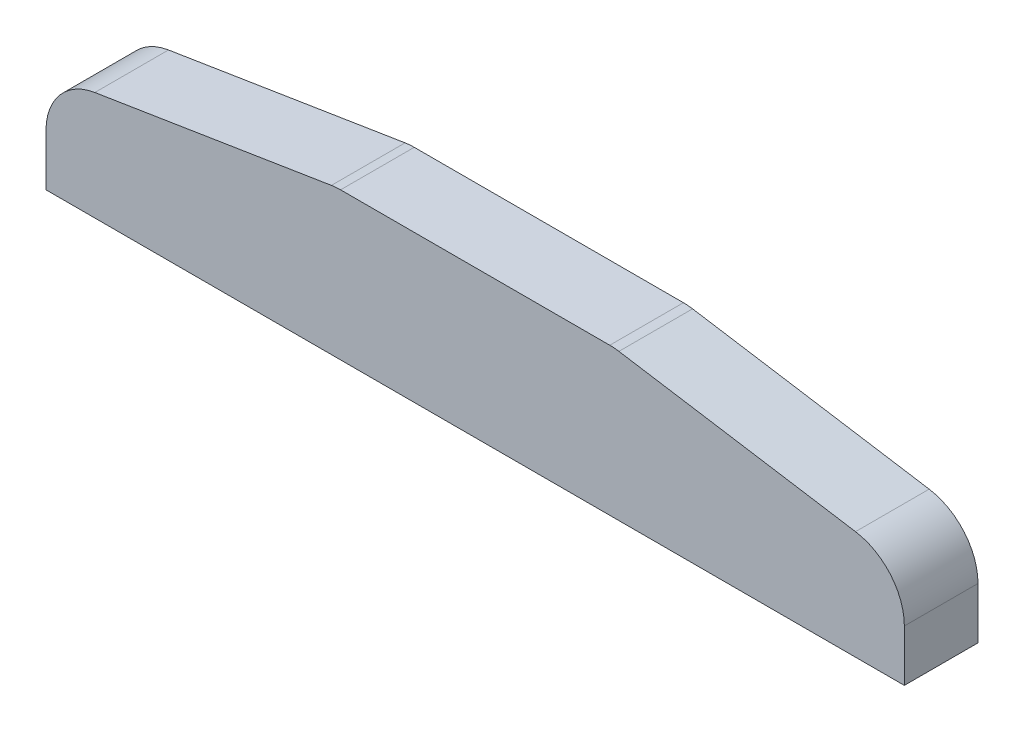
from build123d import *
from OCP.BRepFilletAPI import BRepFilletAPI_MakeChamfer

# Parameters (mm, degrees)
SKETCH1_W                 = 148
SKETCH1_H                 = 12.7
BOSS_EXTRUDE1_DEPTH       = 25.4
CHAMFER1_SIZE             = 8
CHAMFER1_SIZE2            = 50
M5X0_8_TAPPED_HOLE1_D     = 4.2
M5X0_8_TAPPED_HOLE1_DEPTH = 12
M5X0_8_TAPPED_HOLE1_TIP   = 1.2618073
FILLET1_R                 = 10


with BuildPart() as part:
    # Sketch1 → Boss-Extrude1 (new body)
    with BuildSketch(Plane(origin=(0, 0, 0), x_dir=(1, 0, 0), z_dir=(0, 1, 0))):
        Rectangle(SKETCH1_W, SKETCH1_H)
    extrude(amount=BOSS_EXTRUDE1_DEPTH)

    # Chamfer1: one chamfer whose edges measure the first distance from different faces: ONE call of the kernel's chamfer builder (chamfer() names one face for all edges)
    chamfer1_edges_1 = [part.edges().sort_by_distance(p)[0] for p in [
        (-74, 25.4, 0),
    ]]
    chamfer1_side_1 = [part.faces().sort_by_distance(p)[0] for p in [
        (-74, 12.7, 0),
    ]]
    chamfer1_edges_2 = [part.edges().sort_by_distance(p)[0] for p in [
        (74, 25.4, 0),
    ]]
    chamfer1_side_2 = [part.faces().sort_by_distance(p)[0] for p in [
        (74, 12.7, 0),
    ]]
    chamfer1 = BRepFilletAPI_MakeChamfer(part.part.solid().wrapped)
    for e in chamfer1_edges_1:
        chamfer1.Add(CHAMFER1_SIZE, CHAMFER1_SIZE2, e.wrapped, chamfer1_side_1[0].wrapped)  # the first distance lies on this face
    for e in chamfer1_edges_2:
        chamfer1.Add(CHAMFER1_SIZE, CHAMFER1_SIZE2, e.wrapped, chamfer1_side_2[0].wrapped)  # the first distance lies on this face
    add(Compound.cast(chamfer1.Shape()), mode=Mode.REPLACE)

    # M5x0.8 Tapped Hole1
    with Locations(Plane(origin=(0, 0, 0), x_dir=(-1, 0, 0), z_dir=(0, -1, 0))):
        with Locations((66, 0), (22, 0), (-22, 0), (-66, 0)):
            Hole(M5X0_8_TAPPED_HOLE1_D / 2, depth=M5X0_8_TAPPED_HOLE1_DEPTH)
            with Locations((0, 0, -(M5X0_8_TAPPED_HOLE1_DEPTH + M5X0_8_TAPPED_HOLE1_TIP / 2))):  # 118° drill point
                Cone(0, M5X0_8_TAPPED_HOLE1_D / 2, M5X0_8_TAPPED_HOLE1_TIP, mode=Mode.SUBTRACT)

    # Fillet1
    fillet1_edges = [part.edges().sort_by_distance(p)[0] for p in [
        (-24, 25.4, 0),
        (24, 25.4, 0),
        (74, 17.4, 0),
        (-74, 17.4, 0),
    ]]
    fillet(fillet1_edges, radius=FILLET1_R)


solid = part.part
